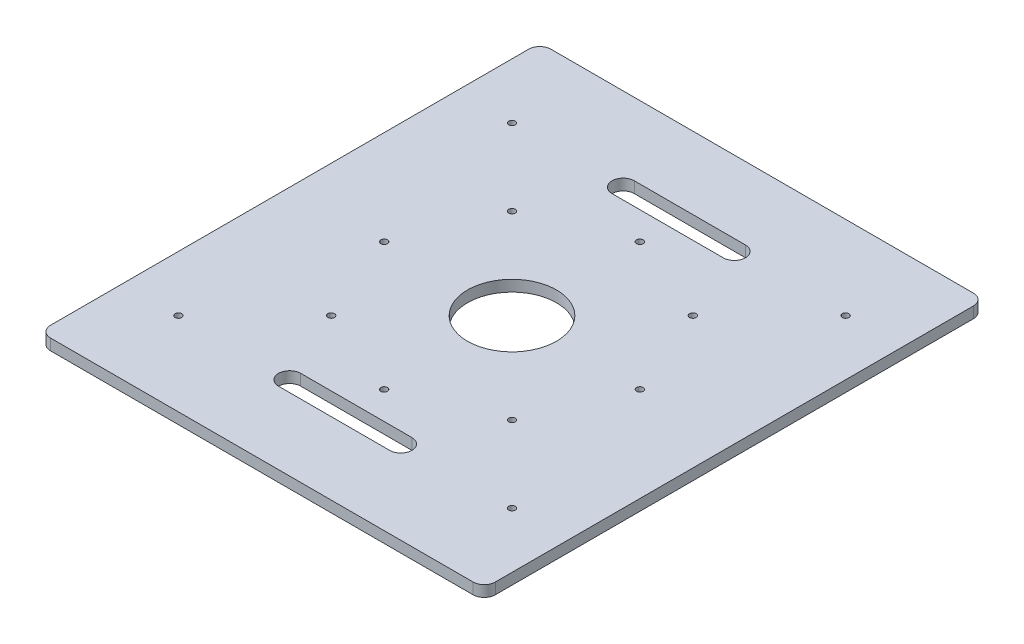
from build123d import *

# Parameters (mm, degrees)
EXTRUDE_1_DEPTH     = 10
SKETCH_3_R          = 40
SKETCH_3_R_2        = 3
CUT_EXTRUDE_1_DEPTH = 15


with BuildPart() as part:
    # 草圖1 → 填料-伸長1 (new body)
    with BuildSketch(Plane(origin=(0, 0, 0), x_dir=(1, 0, 0), z_dir=(0, 1, 0))):
        with BuildLine():
            Line((-200, 215), (-200, -215))
            ThreePointArc((-200, -215), (-197.071067812, -222.071067812), (-190, -225))
            Line((-190, -225), (190, -225))
            ThreePointArc((190, -225), (197.071067812, -222.071067812), (200, -215))
            Line((200, -215), (200, 215))
            ThreePointArc((200, 215), (197.071067812, 222.071067812), (190, 225))
            Line((190, 225), (-190, 225))
            ThreePointArc((-190, 225), (-197.071067812, 222.071067812), (-200, 215))
        make_face()
    extrude(amount=EXTRUDE_1_DEPTH)

    # 草圖3 → 除料-伸長1 (cut)
    with BuildSketch(Plane(origin=(0, 10, 0), x_dir=(1, 0, 0), z_dir=(0, 1, 0))):
        with Locations(Location((0, 0, 0), (0, 0, 270))):
            Circle(SKETCH_3_R)
        with Locations(Location((0, 115, 0), (0, 0, 270))):
            Circle(SKETCH_3_R_2)
        with Locations(Location((81.317279836, 81.317279836, 0), (0, 0, 270))):
            Circle(SKETCH_3_R_2)
        with Locations(Location((115, 0, 0), (0, 0, 270))):
            Circle(SKETCH_3_R_2)
        with Locations(Location((81.317279836, -81.317279836, 0), (0, 0, 270))):
            Circle(SKETCH_3_R_2)
        with Locations(Location((0, -115, 0), (0, 0, 270))):
            Circle(SKETCH_3_R_2)
        with Locations(Location((-81.317279836, -81.317279836, 0), (0, 0, 270))):
            Circle(SKETCH_3_R_2)
        with Locations(Location((-115, 0, 0), (0, 0, 270))):
            Circle(SKETCH_3_R_2)
        with Locations(Location((-81.317279836, 81.317279836, 0), (0, 0, 270))):
            Circle(SKETCH_3_R_2)
        with Locations(Location((-150, 150, 0), (0, 0, 270))):
            Circle(SKETCH_3_R_2)
        with Locations(Location((150, 150, 0), (0, 0, 270))):
            Circle(SKETCH_3_R_2)
        with Locations(Location((-150, -150, 0), (0, 0, 270))):
            Circle(SKETCH_3_R_2)
        with Locations(Location((150, -150, 0), (0, 0, 270))):
            Circle(SKETCH_3_R_2)
        with BuildLine():
            Line((-50, -140), (50, -140))
            ThreePointArc((50, -140), (60, -150), (50, -160))
            Line((50, -160), (-50, -160))
            ThreePointArc((-50, -160), (-60, -150), (-50, -140))
        make_face()
        with BuildLine():
            Line((-50, 140), (50, 140))
            ThreePointArc((50, 140), (60, 150), (50, 160))
            Line((50, 160), (-50, 160))
            ThreePointArc((-50, 160), (-60, 150), (-50, 140))
        make_face()
    extrude(amount=-CUT_EXTRUDE_1_DEPTH, mode=Mode.SUBTRACT)


solid = part.part
